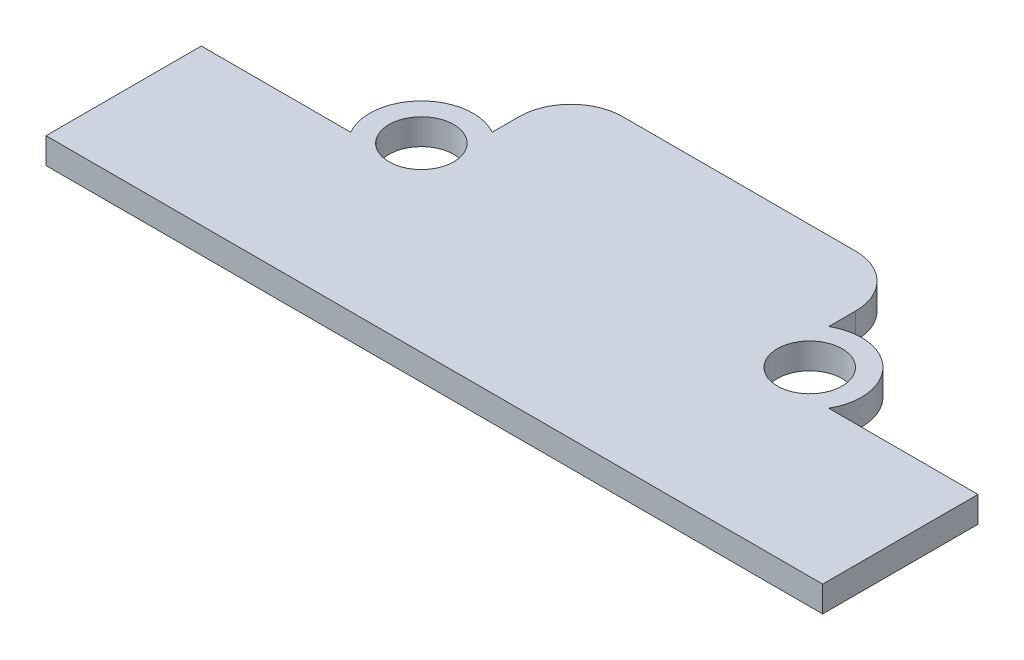
from build123d import *

# Parameters (mm, degrees)
BOSS_EXTRU_1_DEPTH      = 1
ESQUISSE2_R             = 2
BOSS_EXTRU_2_DEPTH      = 1
ESQUISSE3_R             = 1.25
ENL_V_MAT_EXTRU_1_DEPTH = 33.243620766
CONG_1_R                = 2


with BuildPart() as part:
    # Esquisse1 → Boss.-Extru.1 (new body)
    with BuildSketch(Plane(origin=(0, 0, 0), x_dir=(1, 0, 0), z_dir=(0, 1, 0))):
        Polygon((21.5, 6), (30, 6), (30, 0), (0, 0), (0, 6), (8.5, 6), (8.5, 11.775019325), (21.5, 11.775019325), align=None)
    extrude(amount=BOSS_EXTRU_1_DEPTH)

    # Esquisse2 → Boss.-Extru.2 (add)
    with BuildSketch(Plane(origin=(0, 1, 0), x_dir=(1, 0, 0), z_dir=(0, 1, 0))):
        with Locations((7.5, 7)):
            Circle(ESQUISSE2_R)
        with Locations((22.5, 7)):
            Circle(ESQUISSE2_R)
    extrude(amount=-BOSS_EXTRU_2_DEPTH)

    # Esquisse3 → Enlèv. mat.-Extru.1 (cut, through all)
    with BuildSketch(Plane(origin=(0, 1, 0), x_dir=(1, 0, 0), z_dir=(0, 1, 0))):
        with Locations(Location((7.5, 7, 0), (0, 0, 270))):
            Circle(ESQUISSE3_R)
        with Locations(Location((22.5, 7, 0), (0, 0, 270))):
            Circle(ESQUISSE3_R)
    extrude(amount=-ENL_V_MAT_EXTRU_1_DEPTH, mode=Mode.SUBTRACT)

    # Congé1
    cong_1_edges = [part.edges().sort_by_distance(p)[0] for p in [
        (8.5, 0.5, -11.775019325),
        (21.5, 0.5, -11.775019325),
    ]]
    fillet(cong_1_edges, radius=CONG_1_R)


solid = part.part
